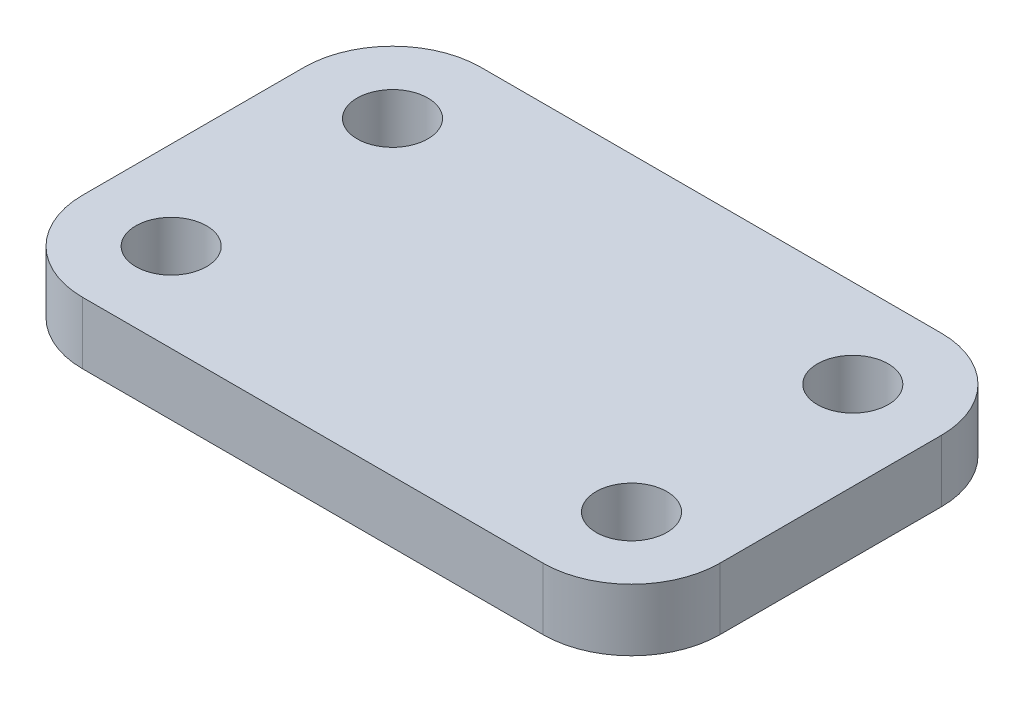
from build123d import *

# Parameters (mm, degrees)
CROQUIS1_W              = 72
CROQUIS1_H              = 45
SALIENTE_EXTRUIR1_DEPTH = 7
REDONDEO1_R             = 10
REDONDEO2_R             = 10
CROQUIS2_R              = 4
CORTAR_EXTRUIR1_DEPTH   = 7


with BuildPart() as part:
    # Croquis1 → Saliente-Extruir1 (new body)
    with BuildSketch(Plane(origin=(0, 0, 0), x_dir=(1, 0, 0), z_dir=(0, 1, 0))):
        Rectangle(CROQUIS1_W, CROQUIS1_H)
    extrude(amount=SALIENTE_EXTRUIR1_DEPTH)

    # Redondeo1
    redondeo1_edges = [part.edges().sort_by_distance(p)[0] for p in [
        (36, 3.5, 22.5),
    ]]
    fillet(redondeo1_edges, radius=REDONDEO1_R)

    # Redondeo2
    redondeo2_edges = [part.edges().sort_by_distance(p)[0] for p in [
        (-36, 3.5, 22.5),
        (-36, 3.5, -22.5),
        (36, 3.5, -22.5),
    ]]
    fillet(redondeo2_edges, radius=REDONDEO2_R)

    # Croquis2 → Cortar-Extruir1 (cut)
    with BuildSketch(Plane(origin=(0, 7, 0), x_dir=(1, 0, 0), z_dir=(0, 1, 0))):
        with Locations(Location((-26, 12.5, 0), (0, 0, 270))):
            Circle(CROQUIS2_R)
        with Locations(Location((-26, -12.5, 0), (0, 0, 270))):
            Circle(CROQUIS2_R)
        with Locations(Location((26, -12.5, 0), (0, 0, 270))):
            Circle(CROQUIS2_R)
        with Locations(Location((26, 12.5, 0), (0, 0, 270))):
            Circle(CROQUIS2_R)
    extrude(amount=-CORTAR_EXTRUIR1_DEPTH, mode=Mode.SUBTRACT)


solid = part.part
